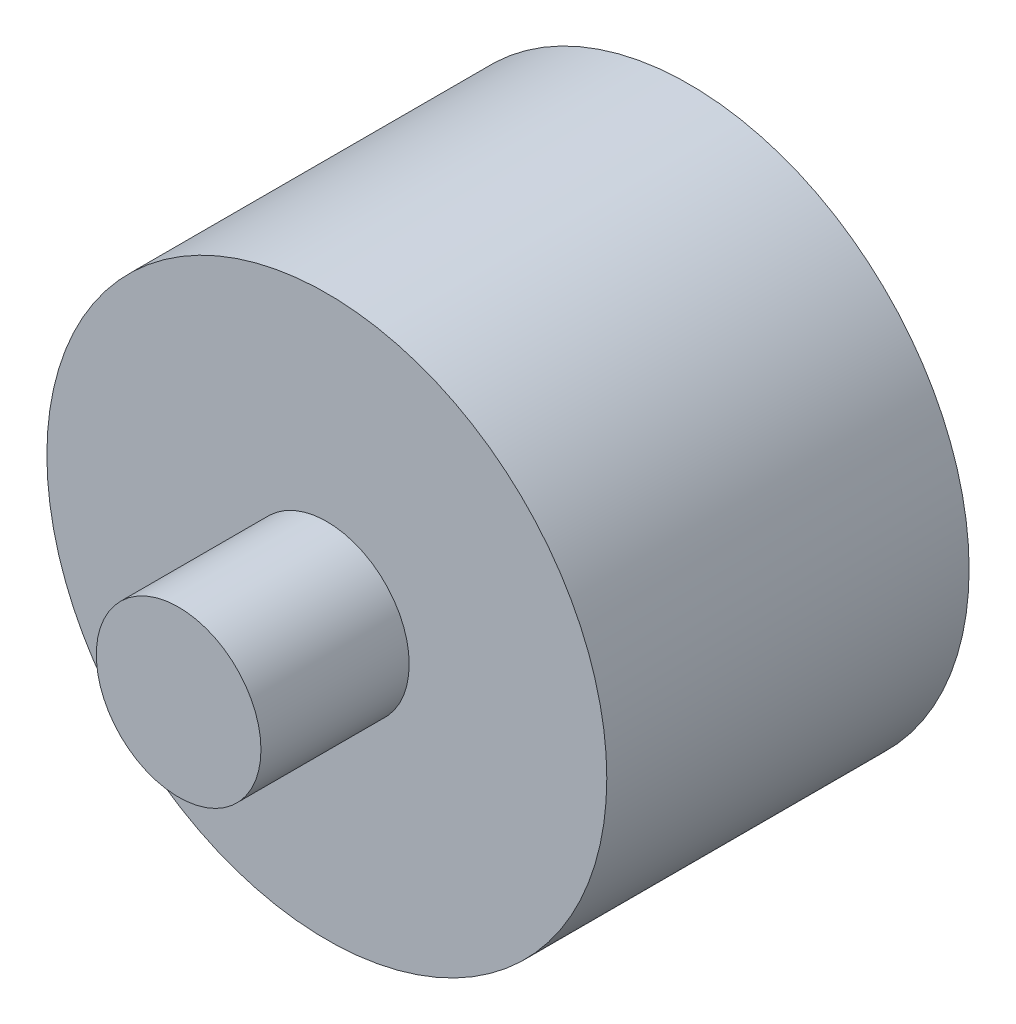
from build123d import *

# Parameters (mm, degrees)
IZIM1_R                     = 17
Y_KSEKLIK_EKSTR_ZYON1_DEPTH = 22
IZIM1_3_R                   = 5
Y_KSEKLIK_EKSTR_ZYON2_DEPTH = 31


with BuildPart() as part:
    # Çizim1 → Yükseklik-Ekstrüzyon1 (new body)
    with BuildSketch(Plane.XY):
        Circle(IZIM1_R)
    extrude(amount=Y_KSEKLIK_EKSTR_ZYON1_DEPTH)

    # Çizim1<3> → Yükseklik-Ekstrüzyon2 (add)
    with BuildSketch(Plane.XY):
        Circle(IZIM1_3_R)
    extrude(amount=Y_KSEKLIK_EKSTR_ZYON2_DEPTH)


solid = part.part
